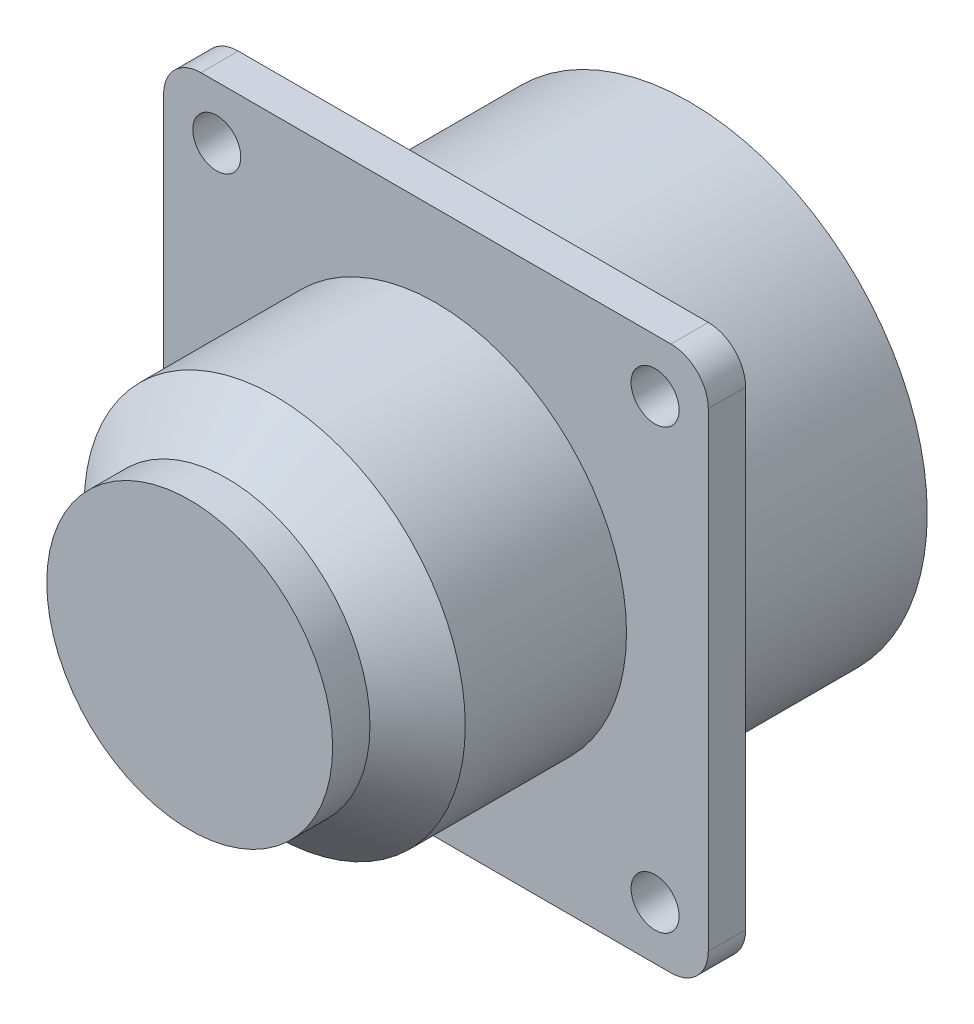
from build123d import *

# Parameters (mm, degrees)
SKETCH2_OUTSIDE_W  = 68.636
SKETCH2_OUTSIDE_H  = 68.636
CUT_EXTRUDE2_DEPTH = 41.588659571
SKETCH4_R          = 1.6002
CUT_EXTRUDE4_DEPTH = 32.872258651


with BuildPart() as part:
    # Sketch1 → Revolve1 (revolve)
    with BuildSketch(Plane(origin=(0, 0, 0), x_dir=(0, 0, -1), z_dir=(1, 0, 0)), mode=Mode.PRIVATE) as revolve1_sk:
        Polygon((-2.4892, 25.4), (0, 25.4), (0, 15.8496), (14.4018, 15.8496), (14.4018, 0), (-18.8976, 0), (-18.8976, 9.525), (-16.4084, 9.525), (-13.2334, 12.7), (-2.4892, 12.7), align=None)
    revolve(revolve1_sk.sketch.rotate(Axis((0, 0, 0), (0, 0, 1)), 90), axis=Axis((0, 0, 0), (0, 0, 1)))

    # Sketch2 outside → Cut-Extrude2 (cut, through all)
    with BuildSketch(Plane.XY):
        Rectangle(SKETCH2_OUTSIDE_W, SKETCH2_OUTSIDE_H)
        with BuildLine():
            Line((-15.6591, 18.1483), (15.6591, 18.1483))
            ThreePointArc((15.6591, 18.1483), (17.4192302, 17.4192302), (18.1483, 15.6591))
            Line((18.1483, 15.6591), (18.1483, -15.6591))
            ThreePointArc((18.1483, -15.6591), (17.4192302, -17.4192302), (15.6591, -18.1483))
            Line((15.6591, -18.1483), (-15.6591, -18.1483))
            ThreePointArc((-15.6591, -18.1483), (-17.4192302, -17.4192302), (-18.1483, -15.6591))
            Line((-18.1483, -15.6591), (-18.1483, 15.6591))
            ThreePointArc((-18.1483, 15.6591), (-17.4192302, 17.4192302), (-15.6591, 18.1483))
        make_face(mode=Mode.SUBTRACT)
    extrude(amount=CUT_EXTRUDE2_DEPTH, mode=Mode.SUBTRACT)

    # Sketch4 → Cut-Extrude4 (cut, through all)
    with BuildSketch(Plane.XY):
        with Locations((-14.605, 14.605)):
            Circle(SKETCH4_R)
        with Locations(Location((14.605, 14.605, 0), (0, 0, 180))):
            Circle(SKETCH4_R)
        with Locations(Location((-14.605, -14.605, 0), (0, 0, 180))):
            Circle(SKETCH4_R)
        with Locations((14.605, -14.605)):
            Circle(SKETCH4_R)
    extrude(amount=CUT_EXTRUDE4_DEPTH, mode=Mode.SUBTRACT)


solid = part.part
